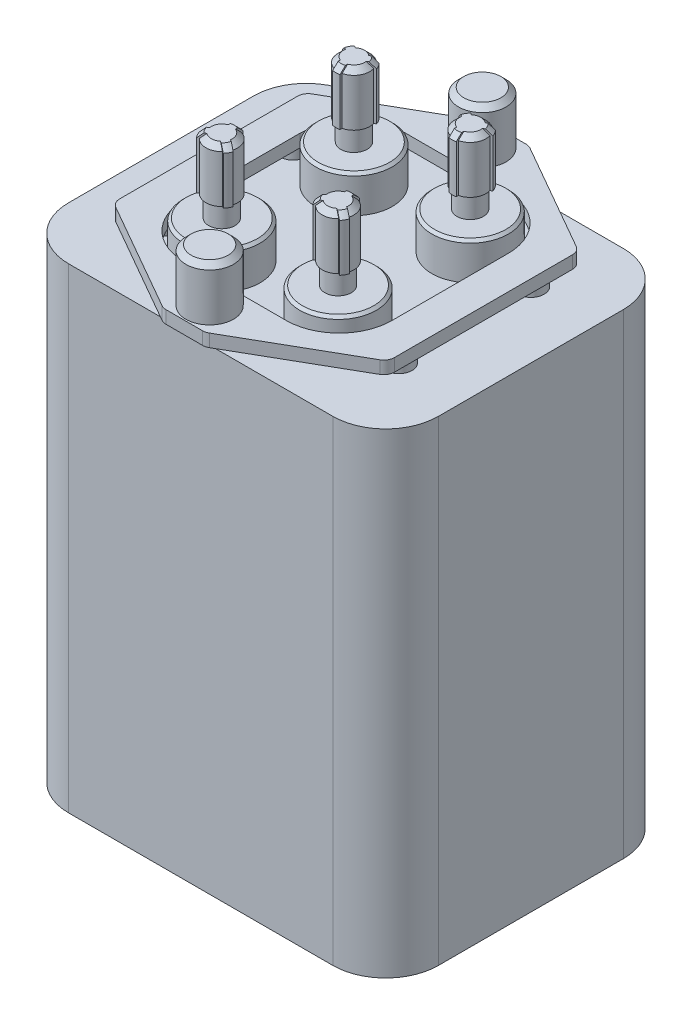
from build123d import *

# Parameters (mm, degrees)
BOSS_EXTRUDE1_DEPTH = 114.3
SKETCH2_R           = 3.175
BOSS_EXTRUDE2_DEPTH = 3.048
SKETCH3_R           = 3.175
BOSS_EXTRUDE3_DEPTH = 3.048
SKETCH4_R           = 9.2075
BOSS_EXTRUDE4_DEPTH = 8.89
CHAMFER1_SIZE       = 0.635
FILLET1_R           = 2.54
SKETCH5_R           = 5.715
BOSS_EXTRUDE5_DEPTH = 12.7
CHAMFER2_SIZE       = 1.27
SKETCH7_R           = 3.175
BOSS_EXTRUDE6_DEPTH = 5.08
SKETCH8_R           = 3.81
SKETCH8_R_2         = 3.175
BOSS_EXTRUDE7_DEPTH = 12.7
CHAMFER3_SIZE       = 1.27
CHAMFER4_SIZE       = 1.27


with BuildPart() as part:
    # Sketch1 → Boss-Extrude1 (new body)
    with BuildSketch(Plane(origin=(0, 0, 0), x_dir=(1, 0, 0), z_dir=(0, 1, 0))):
        with BuildLine():
            Line((-31.75, -34.925), (31.75, -34.925))
            ThreePointArc((31.75, -34.925), (40.730256121, -31.205256121), (44.45, -22.225))
            Line((44.45, -22.225), (44.45, 22.225))
            ThreePointArc((44.45, 22.225), (40.730256121, 31.205256121), (31.75, 34.925))
            Line((31.75, 34.925), (-31.75, 34.925))
            ThreePointArc((-31.75, 34.925), (-40.730256121, 31.205256121), (-44.45, 22.225))
            Line((-44.45, 22.225), (-44.45, -22.225))
            ThreePointArc((-44.45, -22.225), (-40.730256121, -31.205256121), (-31.75, -34.925))
        make_face()
    extrude(amount=-BOSS_EXTRUDE1_DEPTH)

    # Sketch2 → Boss-Extrude2 (add)
    with BuildSketch(Plane(origin=(0, 0, 0), x_dir=(1, 0, 0), z_dir=(0, 1, 0))):
        with Locations(Location((-28.575, 15.875, 0), (0, 0, 90))):
            Circle(SKETCH2_R)
        with Locations(Location((28.575, 15.875, 0), (0, 0, 90))):
            Circle(SKETCH2_R)
        with Locations(Location((28.575, -15.875, 0), (0, 0, 90))):
            Circle(SKETCH2_R)
        with Locations(Location((-28.575, -15.875, 0), (0, 0, 90))):
            Circle(SKETCH2_R)
    extrude(amount=BOSS_EXTRUDE2_DEPTH)

    # Sketch3 → Boss-Extrude3 (add)
    # profile 1 of 2: a face of its own
    with BuildSketch(Plane(origin=(0, 3.048, 0), x_dir=(1, 0, 0), z_dir=(0, 1, 0))):
        Polygon((-33.02, -22.86), (-5.08, -38.862), (5.08, -38.862), (33.02, -22.86), (33.02, 22.86), (5.08, 38.862), (-5.08, 38.862), (-33.02, 22.86), align=None)
        with Locations(Location((-28.575, 15.875, 0), (0, 0, 90))):
            Circle(SKETCH3_R, mode=Mode.SUBTRACT)
        with BuildLine():
            ThreePointArc((-25.019, 13.97), (-21.299256121, 22.950256121), (-12.319, 26.67))
            Line((-12.319, 26.67), (12.319, 26.67))
            ThreePointArc((12.319, 26.67), (21.299256121, 22.950256121), (25.019, 13.97))
            Line((25.019, 13.97), (25.019, -13.97))
            ThreePointArc((25.019, -13.97), (21.299256121, -22.950256121), (12.319, -26.67))
            Line((12.319, -26.67), (-12.319, -26.67))
            ThreePointArc((-12.319, -26.67), (-21.299256121, -22.950256121), (-25.019, -13.97))
            Line((-25.019, -13.97), (-25.019, 13.97))
        make_face(mode=Mode.SUBTRACT)
    # profile 2 of 2: a face of its own
    with BuildSketch(Plane(origin=(0, 3.048, 0), x_dir=(1, 0, 0), z_dir=(0, 1, 0))):
        with Locations(Location((-28.575, 15.875, 0), (0, 0, 90))):
            Circle(SKETCH3_R)
    extrude(amount=BOSS_EXTRUDE3_DEPTH)

    # Sketch4 → Boss-Extrude4 (add)
    with BuildSketch(Plane(origin=(0, 0, 0), x_dir=(1, 0, 0), z_dir=(0, 1, 0))):
        with Locations(Location((13.97, -15.875, 0), (0, 0, 270))):
            Circle(SKETCH4_R)
        with Locations(Location((-13.97, -15.875, 0), (0, 0, 90))):
            Circle(SKETCH4_R)
        with Locations(Location((13.97, 15.875, 0), (0, 0, 90))):
            Circle(SKETCH4_R)
        with Locations(Location((-13.97, 15.875, 0), (0, 0, 270))):
            Circle(SKETCH4_R)
    extrude(amount=BOSS_EXTRUDE4_DEPTH)

    # Chamfer1
    chamfer1_edges = [part.edges().sort_by_distance(p)[0] for p in [
        (13.97, 8.89, 6.6675),
        (-13.97, 8.89, 25.0825),
        (13.97, 8.89, -6.6675),
        (-13.97, 8.89, -25.0825),
    ]]
    chamfer(chamfer1_edges, length=CHAMFER1_SIZE)

    # Fillet1
    fillet1_edges = [part.edges().sort_by_distance(p)[0] for p in [
        (-5.08, 4.572, 38.862),
        (5.08, 4.572, 38.862),
        (33.02, 4.572, 22.86),
        (33.02, 4.572, -22.86),
        (5.08, 4.572, -38.862),
        (-5.08, 4.572, -38.862),
        (-33.02, 4.572, -22.86),
        (-33.02, 4.572, 22.86),
    ]]
    fillet(fillet1_edges, radius=FILLET1_R)

    # Sketch5 → Boss-Extrude5 (add)
    with BuildSketch(Plane(origin=(0, 6.096, 0), x_dir=(1, 0, 0), z_dir=(0, 1, 0))):
        with Locations(Location((0, 32.766, 0), (0, 0, 270))):
            Circle(SKETCH5_R)
        with Locations(Location((0, -32.766, 0), (0, 0, 90))):
            Circle(SKETCH5_R)
    extrude(amount=BOSS_EXTRUDE5_DEPTH)

    # Chamfer2
    chamfer2_edges = [part.edges().sort_by_distance(p)[0] for p in [
        (0, 18.796, -38.481),
        (0, 18.796, 38.481),
    ]]
    chamfer(chamfer2_edges, length=CHAMFER2_SIZE)

    # Sketch7 → Boss-Extrude6 (add)
    with BuildSketch(Plane(origin=(0, 8.89, 0), x_dir=(1, 0, 0), z_dir=(0, 1, 0))):
        with Locations(Location((-13.97, -15.875, 0), (0, 0, 90))):
            Circle(SKETCH7_R)
        with Locations(Location((-13.97, 15.875, 0), (0, 0, 90))):
            Circle(SKETCH7_R)
        with Locations(Location((13.97, 15.875, 0), (0, 0, 90))):
            Circle(SKETCH7_R)
        with Locations(Location((13.97, -15.875, 0), (0, 0, 90))):
            Circle(SKETCH7_R)
    extrude(amount=BOSS_EXTRUDE6_DEPTH)

    # Sketch8 → Boss-Extrude7 (add)
    # profile 1 of 17: a face of its own
    with BuildSketch(Plane(origin=(0, 13.97, 0), x_dir=(1, 0, 0), z_dir=(0, 1, 0))):
        with Locations((-13.97, -15.875)):
            Circle(SKETCH8_R)
        with Locations(Location((-13.97, -15.875, 0), (0, 0, 90))):
            Circle(SKETCH8_R_2, mode=Mode.SUBTRACT)
    # profile 2 of 17: a face of its own
    with BuildSketch(Plane(origin=(0, 13.97, 0), x_dir=(1, 0, 0), z_dir=(0, 1, 0))):
        with BuildLine():
            Line((-17.618863612, -16.971309418), (-18.062340113, -17.227350695))
            ThreePointArc((-18.062340113, -17.227350695), (-17.70256949, -18.03), (-17.187340113, -18.742895151))
            Line((-17.187340113, -18.742895151), (-16.743863612, -18.486853874))
            ThreePointArc((-16.743863612, -18.486853874), (-17.269556788, -17.78), (-17.618863612, -16.971309418))
        make_face()
    # profile 3 of 17: a face of its own
    with BuildSketch(Plane(origin=(0, 13.97, 0), x_dir=(1, 0, 0), z_dir=(0, 1, 0))):
        with BuildLine():
            ThreePointArc((-10.752659887, -18.742895151), (-10.23743051, -18.03), (-9.877659887, -17.227350695))
            Line((-9.877659887, -17.227350695), (-10.321136388, -16.971309418))
            ThreePointArc((-10.321136388, -16.971309418), (-10.670443212, -17.78), (-11.196136388, -18.486853874))
            Line((-11.196136388, -18.486853874), (-10.752659887, -18.742895151))
        make_face()
    # profile 4 of 17: a face of its own
    with BuildSketch(Plane(origin=(0, 13.97, 0), x_dir=(1, 0, 0), z_dir=(0, 1, 0))):
        with BuildLine():
            ThreePointArc((-13.095, -11.654754154), (-13.97, -11.565), (-14.845, -11.654754154))
            Line((-14.845, -11.654754154), (-14.845, -12.166836708))
            ThreePointArc((-14.845, -12.166836708), (-13.97, -12.065), (-13.095, -12.166836708))
            Line((-13.095, -12.166836708), (-13.095, -11.654754154))
        make_face()
    # profile 5 of 17: a face of its own
    with BuildSketch(Plane(origin=(0, 13.97, 0), x_dir=(1, 0, 0), z_dir=(0, 1, 0))):
        with Locations(Location((-13.97, -15.875, 0), (0, 0, 90))):
            Circle(SKETCH8_R_2)
    # profile 6 of 17: a face of its own
    with BuildSketch(Plane(origin=(0, 13.97, 0), x_dir=(1, 0, 0), z_dir=(0, 1, 0))):
        with BuildLine():
            ThreePointArc((9.877659887, -17.227350695), (10.23743051, -18.03), (10.752659887, -18.742895151))
            Line((10.752659887, -18.742895151), (11.196136388, -18.486853874))
            ThreePointArc((11.196136388, -18.486853874), (10.670443212, -17.78), (10.321136388, -16.971309418))
            Line((10.321136388, -16.971309418), (9.877659887, -17.227350695))
        make_face()
    # profile 7 of 17: a face of its own
    with BuildSketch(Plane(origin=(0, 13.97, 0), x_dir=(1, 0, 0), z_dir=(0, 1, 0))):
        with BuildLine():
            ThreePointArc((17.187340113, -18.742895151), (17.70256949, -18.03), (18.062340113, -17.227350695))
            Line((18.062340113, -17.227350695), (17.618863612, -16.971309418))
            ThreePointArc((17.618863612, -16.971309418), (17.269556788, -17.78), (16.743863612, -18.486853874))
            Line((16.743863612, -18.486853874), (17.187340113, -18.742895151))
        make_face()
    # profile 8 of 17: a face of its own
    with BuildSketch(Plane(origin=(0, 13.97, 0), x_dir=(1, 0, 0), z_dir=(0, 1, 0))):
        with Locations((13.97, -15.875)):
            Circle(SKETCH8_R)
    # profile 9 of 17: a face of its own
    with BuildSketch(Plane(origin=(0, 13.97, 0), x_dir=(1, 0, 0), z_dir=(0, 1, 0))):
        with BuildLine():
            Line((14.845, -12.166836708), (14.845, -11.654754154))
            ThreePointArc((14.845, -11.654754154), (13.97, -11.565), (13.095, -11.654754154))
            Line((13.095, -11.654754154), (13.095, -12.166836708))
            ThreePointArc((13.095, -12.166836708), (13.97, -12.065), (14.845, -12.166836708))
        make_face()
    # profile 10 of 17: a face of its own
    with BuildSketch(Plane(origin=(0, 13.97, 0), x_dir=(1, 0, 0), z_dir=(0, 1, 0))):
        with Locations((13.97, 15.875)):
            Circle(SKETCH8_R)
    # profile 11 of 17: a face of its own
    with BuildSketch(Plane(origin=(0, 13.97, 0), x_dir=(1, 0, 0), z_dir=(0, 1, 0))):
        with BuildLine():
            Line((17.618863612, 16.971309418), (18.062340113, 17.227350695))
            ThreePointArc((18.062340113, 17.227350695), (17.70256949, 18.03), (17.187340113, 18.742895151))
            Line((17.187340113, 18.742895151), (16.743863612, 18.486853874))
            ThreePointArc((16.743863612, 18.486853874), (17.269556788, 17.78), (17.618863612, 16.971309418))
        make_face()
    # profile 12 of 17: a face of its own
    with BuildSketch(Plane(origin=(0, 13.97, 0), x_dir=(1, 0, 0), z_dir=(0, 1, 0))):
        with BuildLine():
            ThreePointArc((10.752659887, 18.742895151), (10.23743051, 18.03), (9.877659887, 17.227350695))
            Line((9.877659887, 17.227350695), (10.321136388, 16.971309418))
            ThreePointArc((10.321136388, 16.971309418), (10.670443212, 17.78), (11.196136388, 18.486853874))
            Line((11.196136388, 18.486853874), (10.752659887, 18.742895151))
        make_face()
    # profile 13 of 17: a face of its own
    with BuildSketch(Plane(origin=(0, 13.97, 0), x_dir=(1, 0, 0), z_dir=(0, 1, 0))):
        with BuildLine():
            ThreePointArc((13.095, 11.654754154), (13.97, 11.565), (14.845, 11.654754154))
            Line((14.845, 11.654754154), (14.845, 12.166836708))
            ThreePointArc((14.845, 12.166836708), (13.97, 12.065), (13.095, 12.166836708))
            Line((13.095, 12.166836708), (13.095, 11.654754154))
        make_face()
    # profile 14 of 17: a face of its own
    with BuildSketch(Plane(origin=(0, 13.97, 0), x_dir=(1, 0, 0), z_dir=(0, 1, 0))):
        with Locations((-13.97, 15.875)):
            Circle(SKETCH8_R)
    # profile 15 of 17: a face of its own
    with BuildSketch(Plane(origin=(0, 13.97, 0), x_dir=(1, 0, 0), z_dir=(0, 1, 0))):
        with BuildLine():
            Line((-14.845, 12.166836708), (-14.845, 11.654754154))
            ThreePointArc((-14.845, 11.654754154), (-13.97, 11.565), (-13.095, 11.654754154))
            Line((-13.095, 11.654754154), (-13.095, 12.166836708))
            ThreePointArc((-13.095, 12.166836708), (-13.97, 12.065), (-14.845, 12.166836708))
        make_face()
    # profile 16 of 17: a face of its own
    with BuildSketch(Plane(origin=(0, 13.97, 0), x_dir=(1, 0, 0), z_dir=(0, 1, 0))):
        with BuildLine():
            ThreePointArc((-9.877659887, 17.227350695), (-10.23743051, 18.03), (-10.752659887, 18.742895151))
            Line((-10.752659887, 18.742895151), (-11.196136388, 18.486853874))
            ThreePointArc((-11.196136388, 18.486853874), (-10.670443212, 17.78), (-10.321136388, 16.971309418))
            Line((-10.321136388, 16.971309418), (-9.877659887, 17.227350695))
        make_face()
    # profile 17 of 17: a face of its own
    with BuildSketch(Plane(origin=(0, 13.97, 0), x_dir=(1, 0, 0), z_dir=(0, 1, 0))):
        with BuildLine():
            ThreePointArc((-17.187340113, 18.742895151), (-17.70256949, 18.03), (-18.062340113, 17.227350695))
            Line((-18.062340113, 17.227350695), (-17.618863612, 16.971309418))
            ThreePointArc((-17.618863612, 16.971309418), (-17.269556788, 17.78), (-16.743863612, 18.486853874))
            Line((-16.743863612, 18.486853874), (-17.187340113, 18.742895151))
        make_face()
    extrude(amount=BOSS_EXTRUDE7_DEPTH)

    # Chamfer3
    chamfer3_edges = [part.edges().sort_by_distance(p)[0] for p in [
        (-13.97, 26.67, 19.685),
        (-10.670443212, 26.67, 13.97),
        (-17.269556788, 26.67, 13.97),
        (13.97, 26.67, 19.685),
        (17.269556788, 26.67, 13.97),
        (10.670443212, 26.67, 13.97),
        (17.269556788, 26.67, -13.97),
        (13.97, 26.67, -19.685),
        (10.670443212, 26.67, -13.97),
        (-17.269556788, 26.67, -13.97),
        (-10.670443212, 26.67, -13.97),
        (-13.97, 26.67, -19.685),
    ]]
    chamfer(chamfer3_edges, length=CHAMFER3_SIZE)

    # Chamfer4
    chamfer4_edges = [part.edges().sort_by_distance(p)[0] for p in [
        (-10.23743051, 26.67, 18.03),
        (-13.97, 26.67, 11.565),
        (-17.70256949, 26.67, 18.03),
        (17.70256949, 26.67, 18.03),
        (13.97, 26.67, 11.565),
        (10.23743051, 26.67, 18.03),
        (17.70256949, 26.67, -18.03),
        (10.23743051, 26.67, -18.03),
        (13.97, 26.67, -11.565),
        (-13.97, 26.67, -11.565),
        (-10.23743051, 26.67, -18.03),
        (-17.70256949, 26.67, -18.03),
    ]]
    chamfer(chamfer4_edges, length=CHAMFER4_SIZE)


solid = part.part
